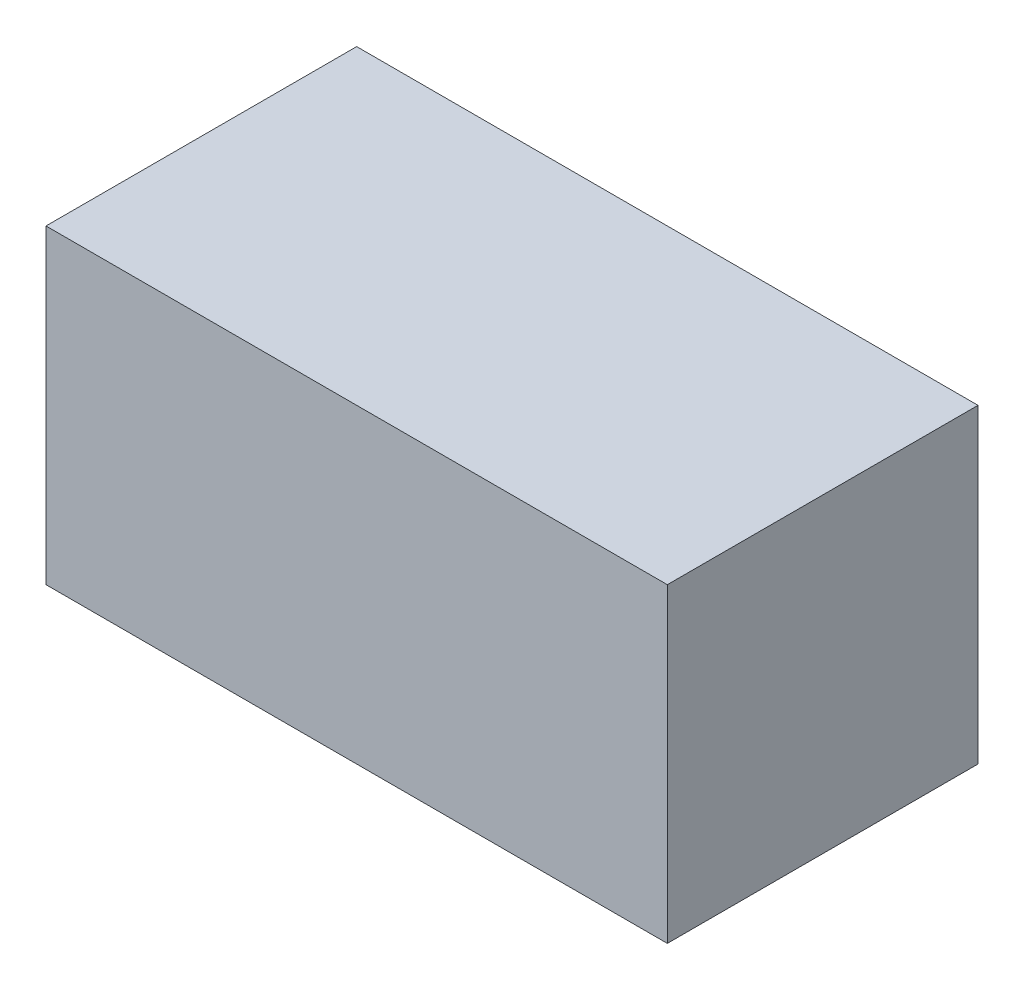
from build123d import *

# Parameters (mm, degrees)
SKETCH1_W      = 12.7
SKETCH1_H      = 6.35
EXTRUDE1_DEPTH = 6.35


with BuildPart() as part:
    # Sketch1 → Extrude1 (new body)
    with BuildSketch(Plane(origin=(0, 0, 0), x_dir=(1, 0, 0), z_dir=(0, 1, 0))):
        Rectangle(SKETCH1_W, SKETCH1_H)
    extrude(amount=-EXTRUDE1_DEPTH)


solid = part.part
